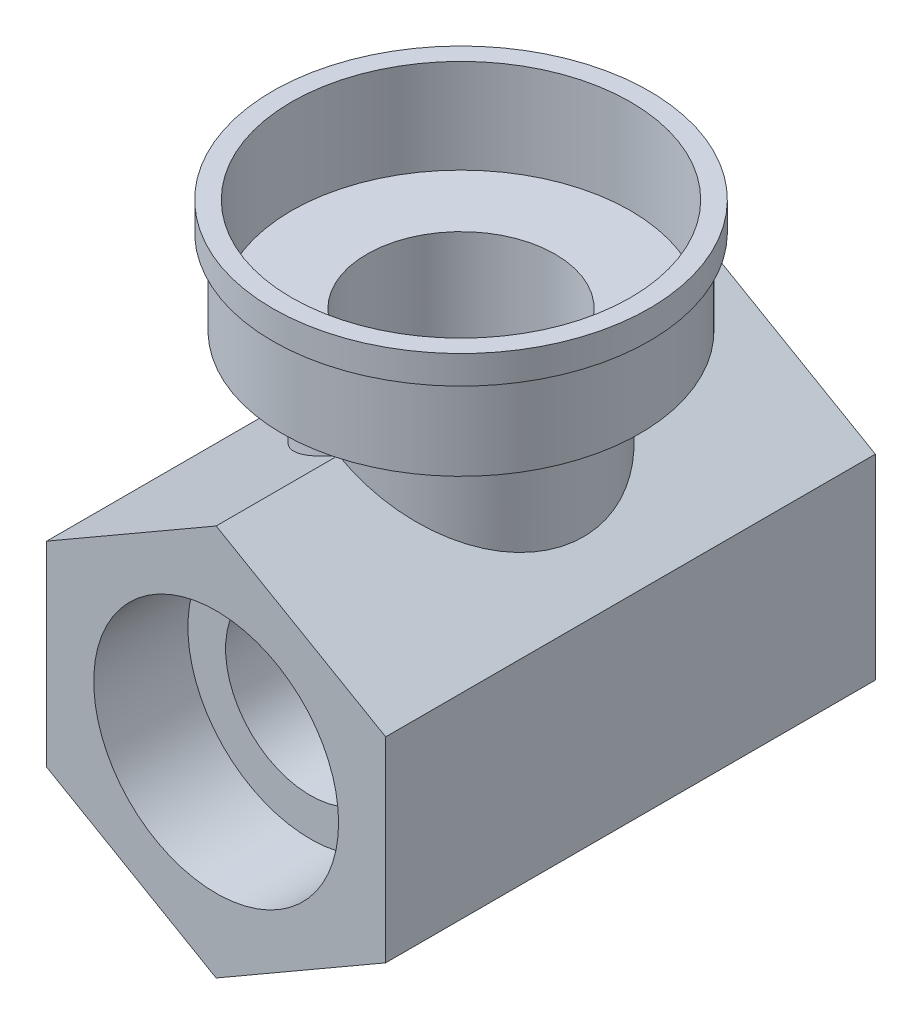
from build123d import *

# Parameters (mm, degrees)
SKETCH4_R           = 20
BOSS_EXTRUDE2_DEPTH = 3
SKETCH5_R           = 19
BOSS_EXTRUDE3_DEPTH = 9
SKETCH6_R           = 13
BOSS_EXTRUDE4_DEPTH = 17
SKETCH7_R           = 18
CUT_EXTRUDE3_DEPTH  = 10
SKETCH8_R           = 10
CUT_EXTRUDE4_DEPTH  = 19
BOSS_EXTRUDE5_DEPTH = 26
SKETCH10_R          = 13
CUT_EXTRUDE5_DEPTH  = 10
SKETCH11_R          = 9
CUT_EXTRUDE6_DEPTH  = 26
CUT_EXTRUDE7_START  = -10
SKETCH12_R          = 13
CUT_EXTRUDE7_DEPTH  = 10
CUT_EXTRUDE8_START  = -20
SKETCH13_R          = 9
CUT_EXTRUDE8_DEPTH  = 20
CUT_EXTRUDE15_DEPTH = 10.15


with BuildPart() as part:
    # Sketch4 → Boss-Extrude2 (new body)
    with BuildSketch(Plane(origin=(0, 0, 0), x_dir=(1, 0, 0), z_dir=(0, 1, 0))):
        with Locations(Location((0, 0, 0), (0, 0, 270))):
            Circle(SKETCH4_R)
    extrude(amount=-BOSS_EXTRUDE2_DEPTH)

    # Sketch5 → Boss-Extrude3 (add)
    with BuildSketch(Plane.XZ.offset(3)):
        with Locations(Location((0, 0, 0), (0, 0, 270))):
            Circle(SKETCH5_R)
    extrude(amount=BOSS_EXTRUDE3_DEPTH)

    # Sketch6 → Boss-Extrude4 (add)
    with BuildSketch(Plane.XZ.offset(12)):
        with Locations(Location((0, 0, 0), (0, 0, 270))):
            Circle(SKETCH6_R)
    extrude(amount=BOSS_EXTRUDE4_DEPTH)

    # Sketch7 → Cut-Extrude3 (cut)
    with BuildSketch(Plane(origin=(0, 0, 0), x_dir=(1, 0, 0), z_dir=(0, 1, 0))):
        with Locations(Location((0, 0, 0), (0, 0, 270))):
            Circle(SKETCH7_R)
    extrude(amount=-CUT_EXTRUDE3_DEPTH, mode=Mode.SUBTRACT)

    # Sketch8 → Cut-Extrude4 (cut)
    with BuildSketch(Plane.XZ.offset(29)):
        with Locations(Location((0, 0, 0), (0, 0, 270))):
            Circle(SKETCH8_R)
    extrude(amount=-CUT_EXTRUDE4_DEPTH, mode=Mode.SUBTRACT)

    # Sketch9 → Boss-Extrude5 (add, symmetric)
    with BuildSketch(Plane.XY):
        Polygon((0, -17), (-18, -27.392304845), (-18, -48.176914536), (0, -58.569219382), (18, -48.176914536), (18, -27.392304845), align=None)
    extrude(amount=BOSS_EXTRUDE5_DEPTH, both=True)

    # Sketch10 → Cut-Extrude5 (cut)
    with BuildSketch(Plane.XY.offset(26)):
        with Locations((0, -37.784609691)):
            Circle(SKETCH10_R)
    extrude(amount=-CUT_EXTRUDE5_DEPTH, mode=Mode.SUBTRACT)

    # Sketch11 → Cut-Extrude6 (cut)
    with BuildSketch(Plane.XY.offset(16)):
        with Locations((0, -37.784609691)):
            Circle(SKETCH11_R)
    extrude(amount=-CUT_EXTRUDE6_DEPTH, mode=Mode.SUBTRACT)

    # Sketch12 → Cut-Extrude7 (cut)
    with BuildSketch(Plane(origin=(0, 0, -26), x_dir=(-1, 0, 0), z_dir=(0, 0, -1)).offset(CUT_EXTRUDE7_START)):
        with Locations(Location((0, -37.784609691, 0), (0, 0, 180))):
            Circle(SKETCH12_R)
    extrude(amount=CUT_EXTRUDE7_DEPTH, mode=Mode.SUBTRACT)

    # Sketch13 → Cut-Extrude8 (cut)
    with BuildSketch(Plane(origin=(0, 0, -16), x_dir=(-1, 0, 0), z_dir=(0, 0, -1)).offset(CUT_EXTRUDE8_START)):
        with Locations(Location((0, -37.784609691, 0), (0, 0, 180))):
            Circle(SKETCH13_R)
    extrude(amount=CUT_EXTRUDE8_DEPTH, mode=Mode.SUBTRACT)

    # Sketch30 → Cut-Extrude15 (cut, symmetric)
    with BuildSketch(Plane(origin=(0, 0, 0), x_dir=(0, 0, -1), z_dir=(1, 0, 0))):
        with BuildLine():
            Line((-15.826629517, -58.510939608), (15.298060877, -58.510939608))
            ThreePointArc((15.298060877, -58.510939608), (13.502204004, -55.924078568), (10.390732376, -55.438592985))
            ThreePointArc((10.390732376, -55.438592985), (0.01479369, -56.801466399), (-10.38951563, -55.675466788))
            ThreePointArc((-10.38951563, -55.675466788), (-13.769795356, -55.824327649), (-15.826629517, -58.510939608))
        make_face()
    extrude(amount=CUT_EXTRUDE15_DEPTH, both=True, mode=Mode.SUBTRACT)

    # Sketch36 → Cut-Revolve2 (revolve, cut)
    with BuildSketch(Plane(origin=(0, 0, 0), x_dir=(0, 0, -1), z_dir=(1, 0, 0))):
        with BuildLine():
            Line((-7, -52.801466399), (0, -52.801466399))
            Line((0, -52.801466399), (0, -17))
            Line((0, -17), (-10, -17))
            Line((-10, -17), (-10, -27))
            Line((-10, -27), (-9, -28.785233738))
            Line((-9, -28.785233738), (-7, -49))
            ThreePointArc((-7, -49), (-7.678962882, -50.900733199), (-7, -52.801466399))
        make_face()
    revolve(axis=Axis((0, -17, 0), (0, -1, 0)), mode=Mode.SUBTRACT)


solid = part.part
